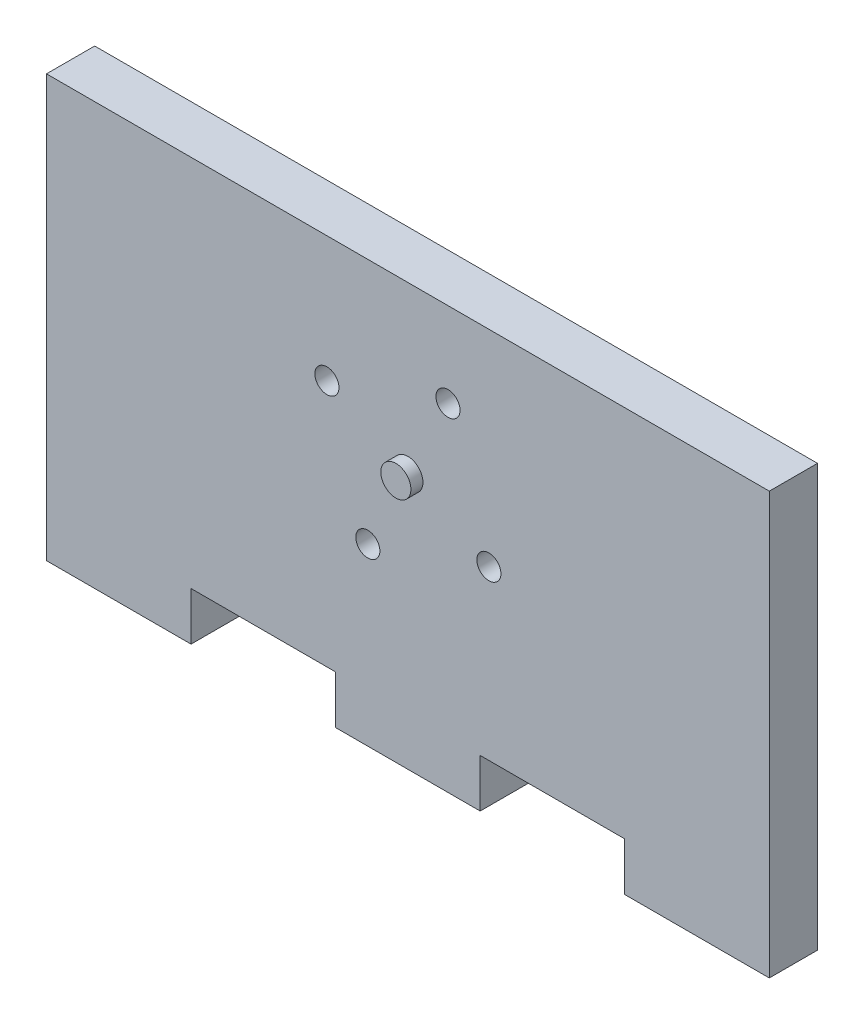
from build123d import *

# Parameters (mm, degrees)
SKETCH1_W           = 76.2
SKETCH1_H           = 44.45
BOSS_EXTRUDE1_DEPTH = 5.08
SKETCH2_R           = 1.5875
BOSS_EXTRUDE6_DEPTH = 6.35
SKETCH3_R           = 1.27
CUT_EXTRUDE1_DEPTH  = 6.35
SKETCH4_W           = 15.24
SKETCH4_H           = 5.08
CUT_EXTRUDE2_DEPTH  = 5.08


with BuildPart() as part:
    # Sketch1 → Boss-Extrude1 (new body)
    with BuildSketch(Plane.XY):
        Rectangle(SKETCH1_W, SKETCH1_H)
    extrude(amount=BOSS_EXTRUDE1_DEPTH)

    # Sketch2 → Boss-Extrude6 (add)
    with BuildSketch(Plane(origin=(0, 0, 0), x_dir=(-1, 0, 0), z_dir=(0, 0, -1))):
        with Locations((0, 4.7625)):
            Circle(SKETCH2_R)
    extrude(amount=-BOSS_EXTRUDE6_DEPTH)

    # Sketch3 → Cut-Extrude1 (cut)
    with BuildSketch(Plane(origin=(0, 0, 0), x_dir=(-1, 0, 0), z_dir=(0, 0, -1))):
        with Locations((4.226013148, -3.773684035)):
            Circle(SKETCH3_R)
        with Locations((-8.536184035, 0.536486852)):
            Circle(SKETCH3_R)
        with Locations((-4.226013147, 13.298684035)):
            Circle(SKETCH3_R)
        with Locations((8.536184035, 8.988513147)):
            Circle(SKETCH3_R)
    extrude(amount=-CUT_EXTRUDE1_DEPTH, mode=Mode.SUBTRACT)

    # Sketch4 → Cut-Extrude2 (cut)
    with BuildSketch(Plane(origin=(0, -22.225, 0), x_dir=(-1, 0, 0), z_dir=(0, -1, 0))):
        with Locations((15.24, -2.54)):
            Rectangle(SKETCH4_W, SKETCH4_H)
        with Locations((-15.24, -2.54)):
            Rectangle(SKETCH4_W, SKETCH4_H)
    extrude(amount=-CUT_EXTRUDE2_DEPTH, mode=Mode.SUBTRACT)


solid = part.part
